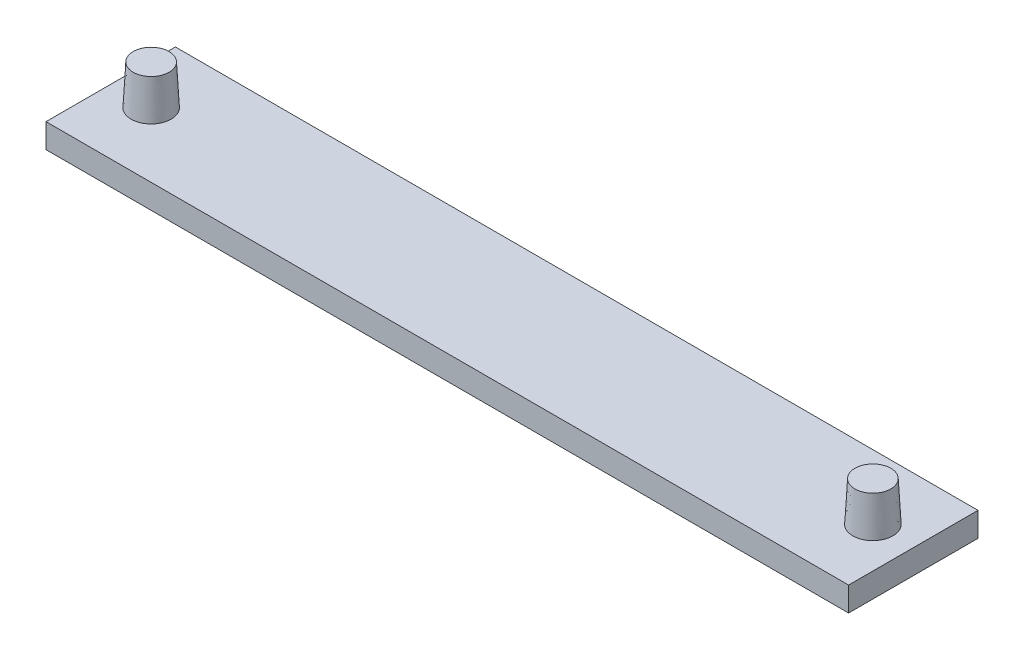
from build123d import *

# Parameters (mm, degrees)
SKETCH1_W                     = 99.25
SKETCH1_H                     = 16
BOSS_EXTRUDE1_DEPTH           = 3
SKETCH2_R                     = 2.475
BOSS_EXTRUDE2_DEPTH           = 4.9
BOSS_EXTRUDE2_DRAFT           = 3
BOSS_EXTRUDE2_PROFILE_2_DEPTH = 4.9
BOSS_EXTRUDE2_PROFILE_2_DRAFT = 3


with BuildPart() as part:
    # Sketch1 → Boss-Extrude1 (new body)
    with BuildSketch(Plane(origin=(0, 0, 0), x_dir=(1, 0, 0), z_dir=(0, 1, 0))):
        with Locations((45.45161309, 5.10225193)):
            Rectangle(SKETCH1_W, SKETCH1_H)
    extrude(amount=BOSS_EXTRUDE1_DEPTH)


with BuildPart() as boss_extrude2_tool:
    # Sketch2 → Boss-Extrude2 (with draft: the straight prism first)
    with BuildSketch(Plane(origin=(0, 3, 0), x_dir=(1, 0, 0), z_dir=(0, 1, 0))):
        with Locations((0.82661309, 5.10225193)):
            Circle(SKETCH2_R)
    extrude(amount=BOSS_EXTRUDE2_DEPTH)
    # Boss-Extrude2: the draft: its side faces are tilted about the plane it starts from
    boss_extrude2_sides = [boss_extrude2_tool.faces().sort_by_distance(p)[0] for p in [
        (-1.64838691, 5.45, -5.10225193),
    ]]
    draft(boss_extrude2_sides, Plane(origin=(0, 3, 0), x_dir=(1, 0, 0), z_dir=(0, 1, 0)), BOSS_EXTRUDE2_DRAFT)


with BuildPart() as part_1:
    add(part.part)

    # Boss-Extrude2: add boss_extrude2_tool
    add(boss_extrude2_tool.part)


with BuildPart() as boss_extrude2_profile_2_tool:
    # Sketch2 → Boss-Extrude2 profile 2 (with draft: the straight prism first)
    with BuildSketch(Plane(origin=(0, 3, 0), x_dir=(1, 0, 0), z_dir=(0, 1, 0))):
        with Locations((90.07661309, 5.10225193)):
            Circle(SKETCH2_R)
    extrude(amount=BOSS_EXTRUDE2_PROFILE_2_DEPTH)
    # Boss-Extrude2 profile 2: the draft: its side faces are tilted about the plane it starts from
    boss_extrude2_profile_2_sides = [boss_extrude2_profile_2_tool.faces().sort_by_distance(p)[0] for p in [
        (87.60161309, 5.45, -5.10225193),
    ]]
    draft(boss_extrude2_profile_2_sides, Plane(origin=(0, 3, 0), x_dir=(1, 0, 0), z_dir=(0, 1, 0)), BOSS_EXTRUDE2_PROFILE_2_DRAFT)


with BuildPart() as part_2:
    add(part_1.part)

    # Boss-Extrude2 profile 2: add boss_extrude2_profile_2_tool
    add(boss_extrude2_profile_2_tool.part)


solid = part_2.part
